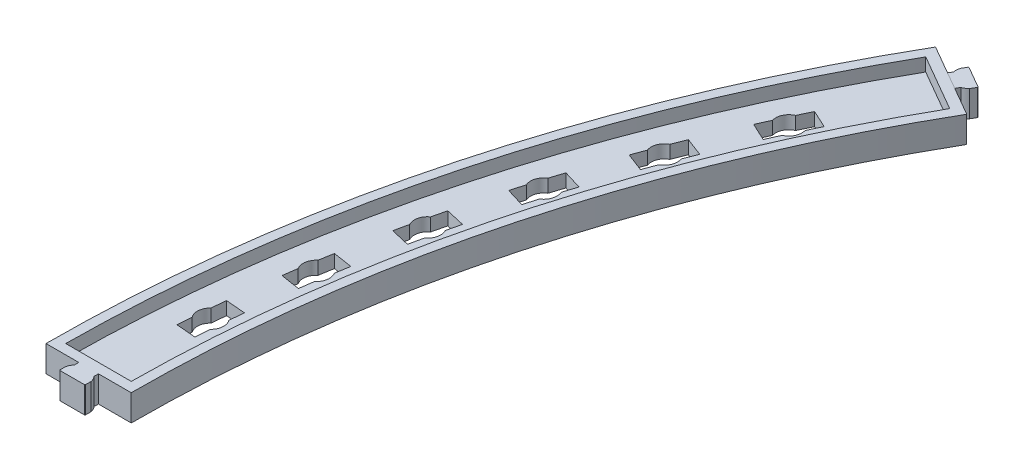
from build123d import *

# Parameters (mm, degrees)
EXTRUDE_1_DEPTH          = 4
CUT_EXTRUDE_1_DEPTH      = 2
CUT_EXTRUDE_2_DEPTH      = 2
PATTERN_CIRCULAR_1_COUNT = 3
PATTERN_CIRCULAR_1_ANGLE = 8
PATTERN_CIRCULAR_2_COUNT = 4
PATTERN_CIRCULAR_2_ANGLE = 12
EXTRUDE_2_DEPTH          = 4
EXTRUDE_3_DEPTH          = 4
FILLET_1_R               = 0.1
FILLET_2_R               = 0.1


with BuildPart() as part:
    # 草图1 → 凸台-拉伸1 (new body)
    with BuildSketch(Plane(origin=(0, 0, 0), x_dir=(1, 0, 0), z_dir=(0, 1, 0))):
        with BuildLine():
            Line((-201, 0), (-214, 0))
            ThreePointArc((-214, 0), (-206.708126826, 55.387275652), (-185.32943641, 107))
            Line((-185.32943641, 107), (-174.071106161, 100.5))
            ThreePointArc((-174.071106161, 100.5), (-194.151091084, 52.022628066), (-201, 0))
        make_face()
    extrude(amount=EXTRUDE_1_DEPTH)

    # 草图2 → 切除-拉伸1 (cut)
    with BuildSketch(Plane(origin=(0, 4, 0), x_dir=(1, 0, 0), z_dir=(0, 1, 0))):
        with BuildLine():
            Line((-212.494705816, 1.5), (-202.494444368, 1.5))
            ThreePointArc((-202.494444368, 1.5), (-195.599979824, 52.410856633), (-176.115332948, 99.948184078))
            Line((-176.115332948, 99.948184078), (-184.775813407, 104.948314803))
            ThreePointArc((-184.775813407, 104.948314803), (-205.259238086, 54.999047084), (-212.494705816, 1.5))
        make_face()
    extrude(amount=-CUT_EXTRUDE_1_DEPTH, mode=Mode.SUBTRACT)

    # 草图3 → 切除-拉伸2 (cut)
    with BuildSketch(Plane(origin=(0, 2, 0), x_dir=(1, 0, 0), z_dir=(0, 1, 0))):
        with BuildLine():
            Line((-199.965750312, 49.494431021), (-202.890115075, 50.165737361))
            ThreePointArc((-202.890115075, 50.165737361), (-203.148104938, 49.11056363), (-203.400607182, 48.054063281))
            ThreePointArc((-203.400607182, 48.054063281), (-204.189084459, 46.872889689), (-203.994692232, 45.466092215))
            ThreePointArc((-203.994692232, 45.466092215), (-204.228241354, 44.405241058), (-204.45627368, 43.343190386))
            Line((-204.45627368, 43.343190386), (-201.531908918, 42.671884046))
            ThreePointArc((-201.531908918, 42.671884046), (-201.303079779, 43.738656489), (-201.068603917, 44.804202024))
            ThreePointArc((-201.068603917, 44.804202024), (-200.290486188, 45.977941915), (-200.478798091, 47.37353181))
            ThreePointArc((-200.478798091, 47.37353181), (-200.225082444, 48.434660732), (-199.965750312, 49.494431021))
        make_face()
    cut_extrude_2 = extrude(amount=-CUT_EXTRUDE_2_DEPTH, mode=Mode.SUBTRACT)

    # 阵列(圆周)1: 切除-拉伸2 ×3 about axis
    pattern_circular_1_axis = Axis((0, 0, 0), (0, 1, 0))
    for i in range(1, PATTERN_CIRCULAR_1_COUNT):
        add(cut_extrude_2.rotate(pattern_circular_1_axis, i * PATTERN_CIRCULAR_1_ANGLE / (PATTERN_CIRCULAR_1_COUNT - 1)), mode=Mode.SUBTRACT)

    # 阵列(圆周)2: 切除-拉伸2 ×4 about axis
    pattern_circular_2_axis = Axis((0, 0, 0), (0, -1, 0))
    for i in range(1, PATTERN_CIRCULAR_2_COUNT):
        add(cut_extrude_2.rotate(pattern_circular_2_axis, i * PATTERN_CIRCULAR_2_ANGLE / (PATTERN_CIRCULAR_2_COUNT - 1)), mode=Mode.SUBTRACT)

    # 草图5 → 凸台-拉伸3 (add)
    with BuildSketch(Plane(origin=(0, 4, 0), x_dir=(1, 0, 0), z_dir=(0, 1, 0))):
        with BuildLine():
            Line((-206, 0), (-209, 0))
            Line((-209, 0), (-209, -0.677124344))
            ThreePointArc((-209, -0.677124344), (-209.280042303, -1.088161527), (-209.45, -1.555590279))
            Line((-209.45, -1.555590279), (-209.45, -2.5))
            Line((-209.45, -2.5), (-205.55, -2.5))
            Line((-205.55, -2.5), (-205.55, -1.555590279))
            ThreePointArc((-205.55, -1.555590279), (-205.719957697, -1.088161527), (-206, -0.677124344))
            Line((-206, -0.677124344), (-206, 0))
        make_face()
    extrude(amount=-EXTRUDE_3_DEPTH)

    # 圆角2
    fillet_2_edges = [part.edges().sort_by_distance(p)[0] for p in [
        (-205.55, 2, 2.5),
        (-209.45, 2, 2.5),
    ]]
    fillet(fillet_2_edges, radius=FILLET_2_R)


with BuildPart() as body_2:
    # 草图4 → 凸台-拉伸2 (new body)
    with BuildSketch(Plane(origin=(0, 4, 0), x_dir=(1, 0, 0), z_dir=(0, 1, 0))):
        with BuildLine():
            Line((-176.761521748, 104.940063509), (-180.139020823, 106.890063509))
            Line((-180.139020823, 106.890063509), (-180.611225683, 106.0721807))
            ThreePointArc((-180.611225683, 106.0721807), (-180.697752376, 105.582396677), (-180.660747219, 105.086406884))
            Line((-180.660747219, 105.086406884), (-180.999309391, 104.5))
            Line((-180.999309391, 104.5), (-178.40123318, 103))
            Line((-178.40123318, 103), (-178.062671007, 103.586406884))
            ThreePointArc((-178.062671007, 103.586406884), (-177.614628668, 103.802354375), (-177.233726608, 104.1221807))
            Line((-177.233726608, 104.1221807), (-176.761521748, 104.940063509))
        make_face()
    extrude(amount=-EXTRUDE_2_DEPTH)

    # 圆角1
    fillet_1_edges = [body_2.edges().sort_by_distance(p)[0] for p in [
        (-180.139020823, 2, -106.890063509),
        (-176.761521748, 2, -104.940063509),
    ]]
    fillet(fillet_1_edges, radius=FILLET_1_R)


solid = Compound([part.part, body_2.part])
